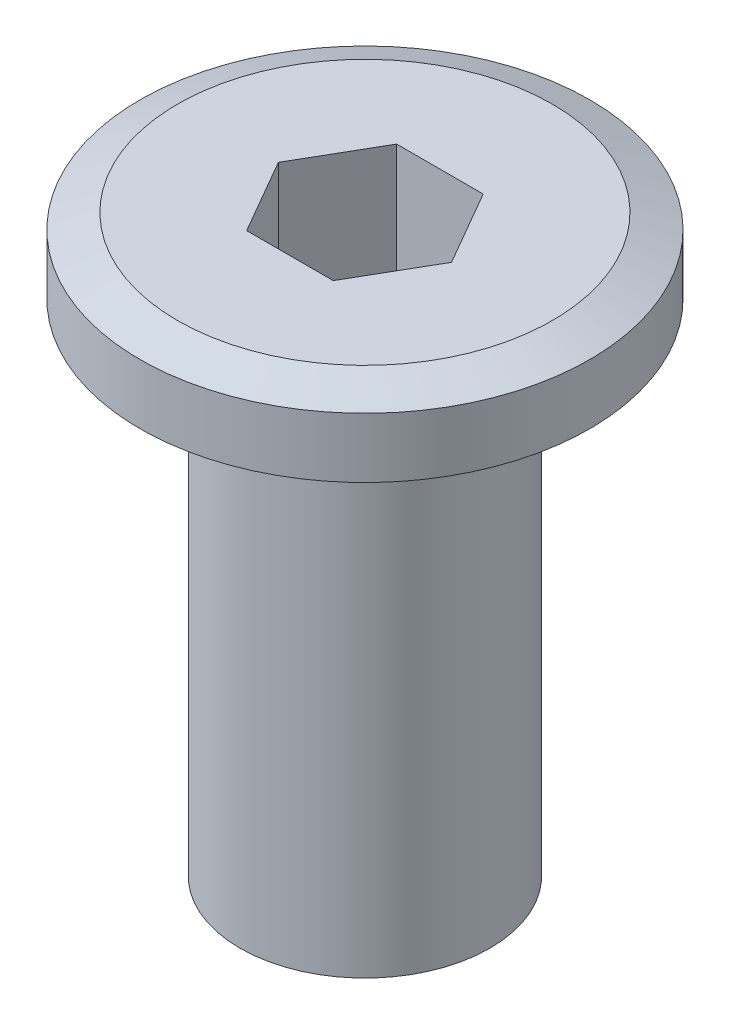
from build123d import *

# Parameters (mm, degrees)
SKETCH3_R           = 2.5
BOSS_EXTRUDE1_DEPTH = 10
CUT_EXTRUDE2_DEPTH  = 3


with BuildPart() as part:
    # Sketch1 → Revolve1 (revolve)
    with BuildSketch(Plane.XY, mode=Mode.PRIVATE) as revolve1_sk:
        Polygon((-2.5, 0), (0, 0), (0, 1.5), (-3.75, 1.5), (-4.5, 1.2), (-4.5, 0), align=None)
    revolve(revolve1_sk.sketch.rotate(Axis((0, 0, 0), (0, 1, 0)), 270), axis=Axis((0, 0, 0), (0, 1, 0)))

    # Sketch3 → Boss-Extrude1 (add)
    with BuildSketch(Plane.XZ):
        with Locations(Location((0, 0, 0), (0, 0, 90))):
            Circle(SKETCH3_R)
    extrude(amount=BOSS_EXTRUDE1_DEPTH)

    # Sketch2 → Cut-Extrude2 (cut)
    with BuildSketch(Plane(origin=(0, 1.5, 0), x_dir=(1, 0, 0), z_dir=(0, 1, 0))):
        Polygon((1.732050808, 0), (0.866025404, 1.5), (-0.866025404, 1.5), (-1.732050808, 0), (-0.866025404, -1.5), (0.866025404, -1.5), align=None)
    extrude(amount=-CUT_EXTRUDE2_DEPTH, mode=Mode.SUBTRACT)


solid = part.part
